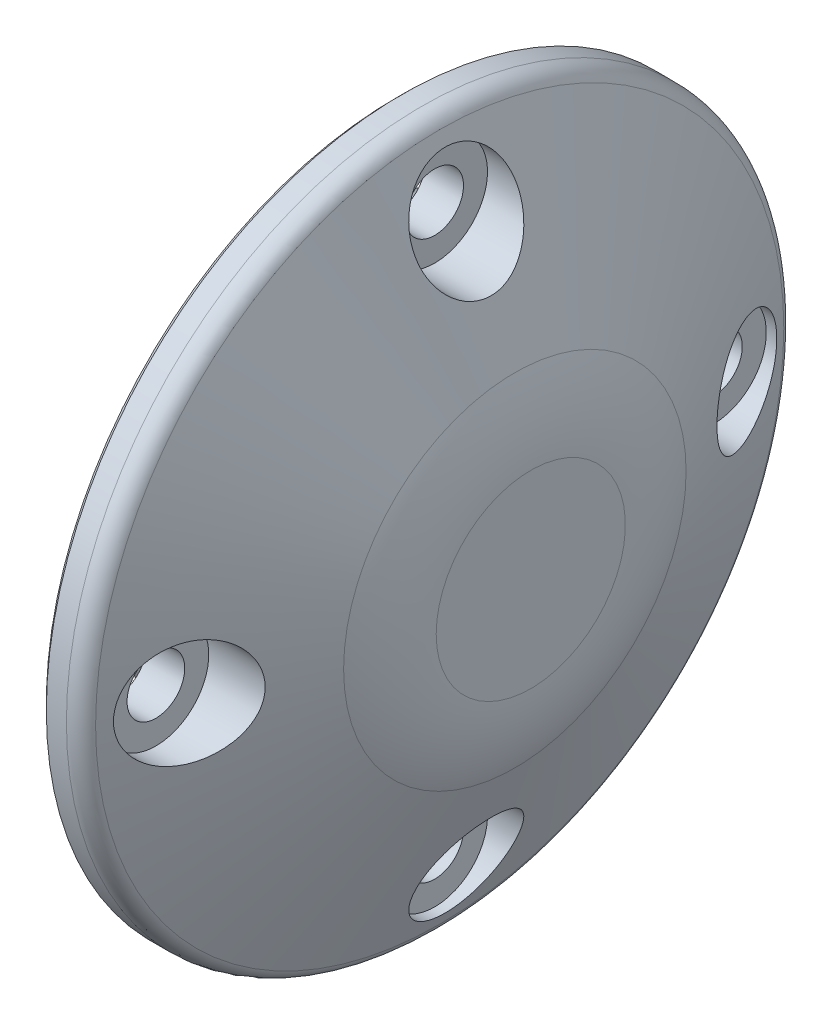
from build123d import *

# Parameters (mm, degrees)
FILLET2_R          = 1
CHAMFER1_SIZE      = 0.3
SKETCH2_R          = 1.5
CUT_EXTRUDE1_DEPTH = 10
SKETCH3_R          = 2.75
CUT_EXTRUDE2_DEPTH = 10


with BuildPart() as part:
    # Sketch1 → Revolve1 (revolve)
    with BuildSketch(Plane.XY, mode=Mode.PRIVATE) as revolve1_sk:
        with BuildLine():
            Line((-10, 7), (-10, 11))
            Line((-10, 11), (-6, 11))
            Line((-6, 11), (-6, 18.5))
            Line((-6, 18.5), (-4.655646626, 18.5))
            ThreePointArc((-4.655646626, 18.5), (-4.107342929, 18.336279293), (-3.73857657, 17.898726111))
            Line((-3.73857657, 17.898726111), (0.170700563, 8.907388706))
            ThreePointArc((0.170700563, 8.907388706), (0.790480214, 6.956422558), (1, 4.920127592))
            Line((1, 4.920127592), (1, 0))
            Line((1, 0), (-2, 0))
            Line((-2, 0), (-2, 7))
            Line((-2, 7), (-10, 7))
        make_face()
    revolve(revolve1_sk.sketch.rotate(Axis((0, 0, 0), (1, 0, 0)), 90), axis=Axis((0, 0, 0), (1, 0, 0)))

    # Fillet2
    fillet2_edges = [part.edges().sort_by_distance(p)[0] for p in [
        (-6, 0, -11),
        (-2, 0, -7),
    ]]
    fillet(fillet2_edges, radius=FILLET2_R)

    # Chamfer1
    chamfer1_edges = [part.edges().sort_by_distance(p)[0] for p in [
        (-6, 0, -18.5),
        (-10, 0, -11),
    ]]
    chamfer(chamfer1_edges, length=CHAMFER1_SIZE)

    # Sketch2 → Cut-Extrude1 (cut)
    with BuildSketch(Plane.ZY.offset(6)):
        with Locations((0, 14.5)):
            Circle(SKETCH2_R)
        with Locations((14.5, 0)):
            Circle(SKETCH2_R)
        with Locations((0, -14.5)):
            Circle(SKETCH2_R)
        with Locations((-14.5, 0)):
            Circle(SKETCH2_R)
    extrude(amount=-CUT_EXTRUDE1_DEPTH, mode=Mode.SUBTRACT)

    # Sketch3 → Cut-Extrude2 (cut)
    with BuildSketch(Plane.ZY.offset(4)):
        with Locations((0, 14.5)):
            Circle(SKETCH3_R)
        with Locations((14.5, 0)):
            Circle(SKETCH3_R)
        with Locations((0, -14.5)):
            Circle(SKETCH3_R)
        with Locations((-14.5, 0)):
            Circle(SKETCH3_R)
    extrude(amount=-CUT_EXTRUDE2_DEPTH, mode=Mode.SUBTRACT)


solid = part.part
